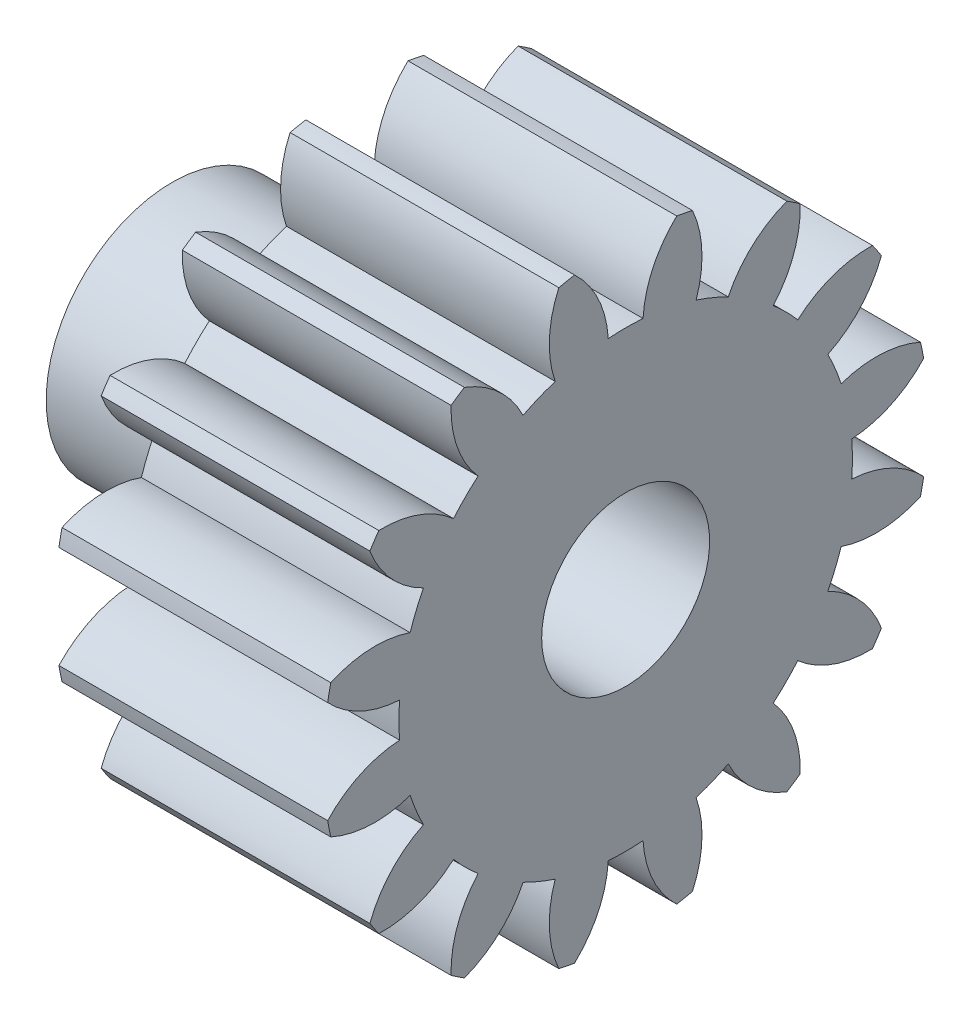
from build123d import *

# Parameters (mm, degrees)
BASPROSKE_W        = 16
BASPROSKE_H        = 18
TOOTHCUT_DEPTH     = 31.066592757
TEETHCUTS_COUNT    = 16
TEETHCUTS_ANGLE    = 337.5
HUBNEAONESKE_R     = 7.5
HUBNEARONE_DEPTH   = 22.0000508
BORSKE_R           = 5
BORE_DEPTH         = 38.0000508
CUT_EXTRUDE1_START = -11
SKETCH1_R          = 7.5
CUT_EXTRUDE1_DEPTH = 11


with BuildPart() as part:
    # BasProSke → Base-Revolve (revolve)
    with BuildSketch(Plane(origin=(0, 0, 0), x_dir=(1, 0, 0), z_dir=(0, 1, 0)), mode=Mode.PRIVATE) as base_revolve_sk:
        with Locations((8, 9)):
            Rectangle(BASPROSKE_W, BASPROSKE_H)
    revolve(base_revolve_sk.sketch.rotate(Axis((-10, 0, 0), (1, 0, 0)), 180), axis=Axis((-10, 0, 0), (1, 0, 0)))

    # TooCutSke → ToothCut (cut, through all)
    with BuildSketch(Plane(origin=(0, 0, 0), x_dir=(0, 0, -1), z_dir=(1, 0, 0))):
        with BuildLine():
            ThreePointArc((1.03434411, 13.459313997), (0, 13.499), (-1.03434411, 13.459313997))
            ThreePointArc((-1.03434411, 13.459313997), (-1.635143665, 15.806872195), (-3.065655864, 17.762792553))
            ThreePointArc((-3.065655864, 17.762792553), (0, 18.0254), (3.065655864, 17.762792553))
            ThreePointArc((3.065655864, 17.762792553), (1.635143665, 15.806872195), (1.03434411, 13.459313997))
        make_face()
    toothcut = extrude(amount=TOOTHCUT_DEPTH, mode=Mode.SUBTRACT)

    # TeethCuts: ToothCut ×16 about axis
    teethcuts_axis = Axis((-10, 0, 0), (1, 0, 0))
    for i in range(1, TEETHCUTS_COUNT):
        add(toothcut.rotate(teethcuts_axis, i * TEETHCUTS_ANGLE / (TEETHCUTS_COUNT - 1)), mode=Mode.SUBTRACT)

    # HubNeaOneSke → HubNearOne (add)
    with BuildSketch(Plane.ZY):
        with Locations(Location((0, 0, 0), (0, 0, 180))):
            Circle(HUBNEAONESKE_R)
    extrude(amount=HUBNEARONE_DEPTH)

    # BorSke → Bore (cut, symmetric)
    with BuildSketch(Plane(origin=(0, 0, 0), x_dir=(0, 0, -1), z_dir=(1, 0, 0))):
        with Locations(Location((0, 0, 0), (0, 0, 180))):
            Circle(BORSKE_R)
    extrude(amount=BORE_DEPTH, both=True, mode=Mode.SUBTRACT)

    # Sketch1 → Cut-Extrude1 (cut)
    with BuildSketch(Plane.ZY.offset(22.0000508).offset(CUT_EXTRUDE1_START)):
        with Locations(Location((0, 0, 0), (0, 0, 180))):
            Circle(SKETCH1_R)
    extrude(amount=CUT_EXTRUDE1_DEPTH, mode=Mode.SUBTRACT)


solid = part.part
